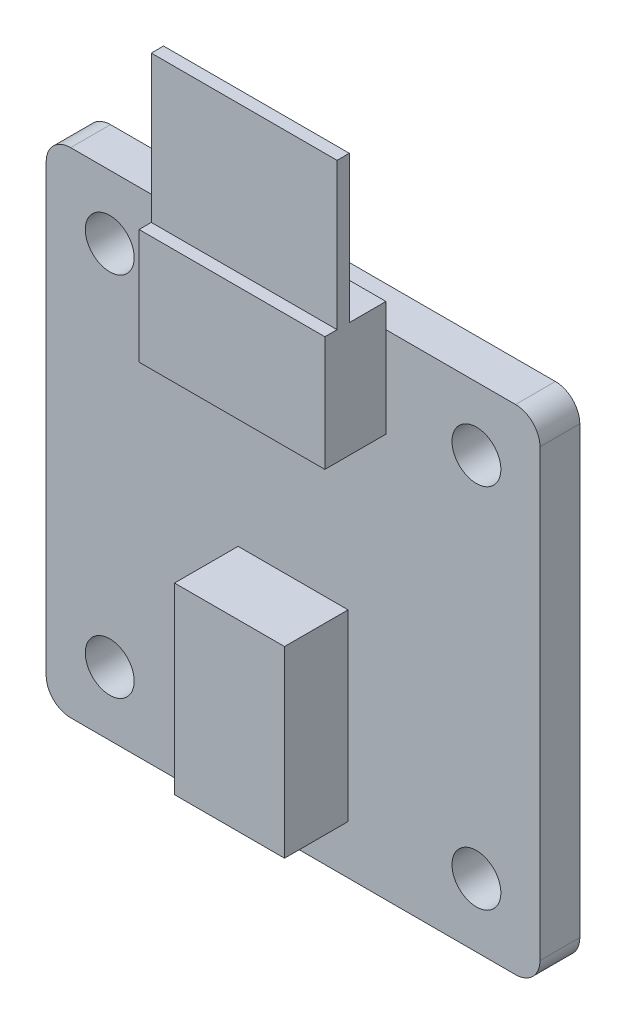
from build123d import *

# Parameters (mm, degrees)
SKETCH_1_W               = 20.2
SKETCH_1_H               = 20.2
EXTRUDE_1_DEPTH          = 1.63
FILLET_1_R               = 1
CUT_EXTRUDE_1_DEPTH      = 5
CUT_EXTRUDE_1_DEPTH_BACK = 15.376261684
SKETCH_2_R               = 1
EXTRUDE_2_DEPTH          = 2.5
EXTRUDE_3_DEPTH          = 2.6
SKETCH_6_W               = 7.6
SKETCH_6_H               = 0.5
EXTRUDE_6_DEPTH          = 6
SKETCH_7_W               = 7.6
SKETCH_7_H               = 6
EXTRUDE_7_DEPTH          = 0.4
SKETCH_8_W               = 7.6
SKETCH_8_H               = 6
CUT_EXTRUDE_2_DEPTH      = 0.4
EXTRUDE_8_DEPTH          = 1.4
SKETCH_10_W              = 6.8
SKETCH_10_H              = 1.6
CUT_EXTRUDE_3_DEPTH      = 1.5


with BuildPart() as part:
    # 草图1 → 凸台-拉伸1 (new body)
    with BuildSketch(Plane.XY):
        Rectangle(SKETCH_1_W, SKETCH_1_H)
    extrude(amount=EXTRUDE_1_DEPTH)

    # 圆角1
    fillet_1_edges = [part.edges().sort_by_distance(p)[0] for p in [
        (10.1, -10.1, 0.815),
        (10.1, 10.1, 0.815),
        (-10.1, 10.1, 0.815),
        (-10.1, -10.1, 0.815),
    ]]
    fillet(fillet_1_edges, radius=FILLET_1_R)

    # 草图2 → 切除-拉伸1 (cut, two sides: drawn at the far end of the back side and taken through both)
    with BuildSketch(Plane.XY.offset(1.63).offset(-CUT_EXTRUDE_1_DEPTH_BACK)):
        with Locations((-7.5, 7.5)):
            Circle(SKETCH_2_R)
        with Locations((7.5, 7.5)):
            Circle(SKETCH_2_R)
        with Locations((7.5, -7.5)):
            Circle(SKETCH_2_R)
        with Locations((-7.5, -7.5)):
            Circle(SKETCH_2_R)
    extrude(amount=CUT_EXTRUDE_1_DEPTH + CUT_EXTRUDE_1_DEPTH_BACK, mode=Mode.SUBTRACT)

    # 草图3 → 凸台-拉伸2 (add)
    with BuildSketch(Plane.XY.offset(1.63)):
        Polygon((0, 6.4), (3.8, 6.4), (3.8, 11.1), (-3.8, 11.1), (-3.8, 6.4), align=None)
    extrude(amount=EXTRUDE_2_DEPTH)

    # 草图4 → 凸台-拉伸3 (add)
    with BuildSketch(Plane.XY.offset(1.63)):
        Polygon((0, -8.1), (-2.25, -8.1), (-2.25, -0.6), (2.25, -0.6), (2.25, -8.1), align=None)
    extrude(amount=EXTRUDE_3_DEPTH)

    # 草图6 → 凸台-拉伸6 (add)
    with BuildSketch(Plane(origin=(0, 11.1, 0), x_dir=(1, 0, 0), z_dir=(0, 1, 0))):
        with Locations((0, -3.78)):
            Rectangle(SKETCH_6_W, SKETCH_6_H)
    extrude(amount=EXTRUDE_6_DEPTH)

    # 草图7 → 凸台-拉伸7 (add)
    with BuildSketch(Plane(origin=(0, 0, 3.53), x_dir=(-1, 0, 0), z_dir=(0, 0, -1))):
        with Locations((0, 14.1)):
            Rectangle(SKETCH_7_W, SKETCH_7_H)
    extrude(amount=EXTRUDE_7_DEPTH)

    # 草图8 → 切除-拉伸2 (cut)
    with BuildSketch(Plane.XY.offset(4.03)):
        with Locations((0, 14.1)):
            Rectangle(SKETCH_8_W, SKETCH_8_H)
    extrude(amount=-CUT_EXTRUDE_2_DEPTH, mode=Mode.SUBTRACT)

    # 草图9 → 凸台-拉伸8 (add)
    with BuildSketch(Plane(origin=(0, 0, 0), x_dir=(-1, 0, 0), z_dir=(0, 0, -1))):
        Polygon((-3.4, 6.1), (0, 6.1), (3.4, 6.1), (3.4, 7.7), (-3.4, 7.7), align=None)
    extrude(amount=EXTRUDE_8_DEPTH)

    # 草图10 → 切除-拉伸3 (cut)
    with BuildSketch(Plane(origin=(6.414908285, 4.302749918, 0), x_dir=(1, 0, 0), z_dir=(0, 0, 1))):
        with Locations((-6.414908285, 2.597250082)):
            Rectangle(SKETCH_10_W, SKETCH_10_H)
    extrude(amount=-CUT_EXTRUDE_3_DEPTH, mode=Mode.SUBTRACT)


solid = part.part
